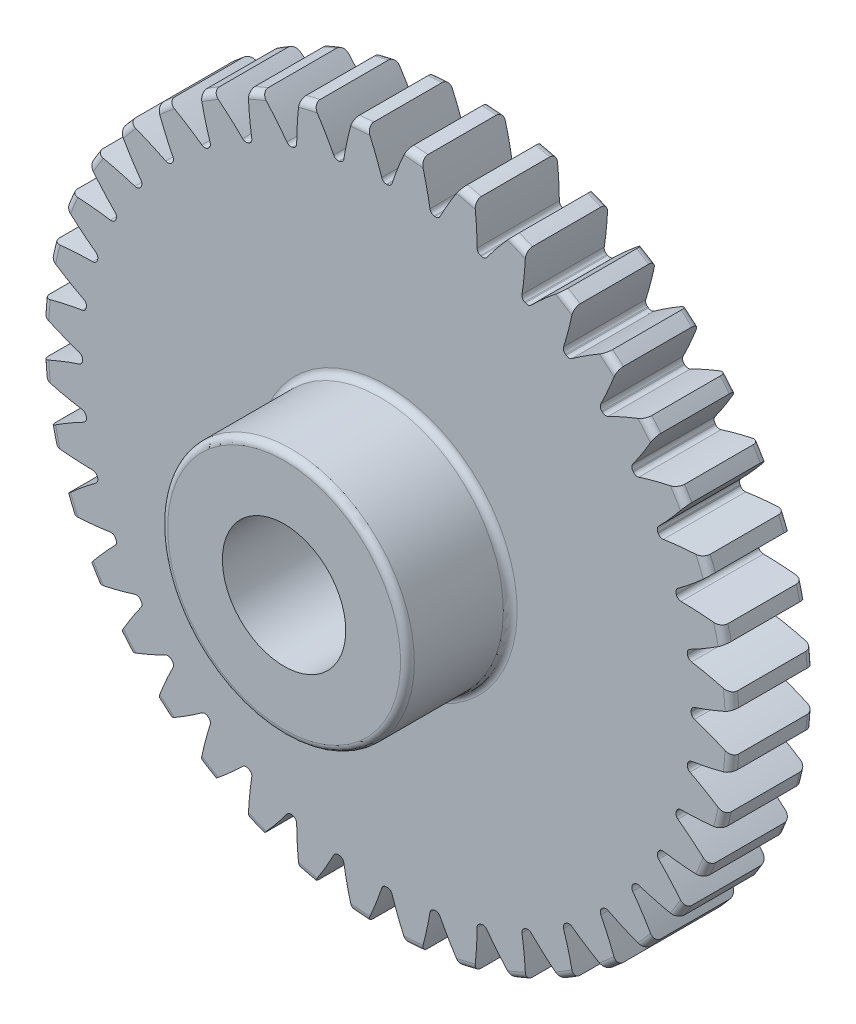
from build123d import *

# Parameters (mm, degrees)
FILLET2_R          = 0.336
CUT_EXTRUDE2_DEPTH = 25.279209282
CIRPATTERN1_COUNT  = 40


with BuildPart() as part:
    # Sketch4 → Revolve1 (revolve)
    with BuildSketch(Plane(origin=(0, 0, 0), x_dir=(0, 0, -1), z_dir=(1, 0, 0))):
        Polygon((-9, 3), (-9, 6), (-4, 6), (-4, 16.8), (0, 16.8), (0, 3), align=None)
    revolve(axis=Axis((0, 0, 4), (0, 0, 1)))

    # Fillet2
    fillet2_edges = [part.edges().sort_by_distance(p)[0] for p in [
        (0, -16.8, 0),
        (0, -16.8, 4),
        (0, -6, 4),
        (0, -6, 9),
    ]]
    fillet(fillet2_edges, radius=FILLET2_R)

    # Sketch7 → Cut-Extrude2 (cut, through all)
    with BuildSketch(Plane.XY.offset(4)):
        with BuildLine():
            ThreePointArc((-0.021567186, 14.799984286), (0, 14.8), (0.021567186, 14.799984286))
            ThreePointArc((0.021567186, 14.799984286), (0.162272627, 14.84530001), (0.249739517, 14.964468291))
            ThreePointArc((0.249739517, 14.964468291), (0.584218852, 15.879135198), (0.973727712, 16.77175764))
            ThreePointArc((0.973727712, 16.77175764), (0, 16.8), (-0.973727712, 16.77175764))
            ThreePointArc((-0.973727712, 16.77175764), (-0.584218852, 15.879135198), (-0.249739517, 14.964468291))
            ThreePointArc((-0.249739517, 14.964468291), (-0.162272627, 14.84530001), (-0.021567186, 14.799984286))
        make_face()
    cut_extrude2 = extrude(amount=-CUT_EXTRUDE2_DEPTH, mode=Mode.SUBTRACT)

    # CirPattern1: Cut-Extrude2 ×40 about axis
    cirpattern1_axis = Axis((0, 0, 0), (0, 0, 1))
    for i in range(1, CIRPATTERN1_COUNT):
        add(cut_extrude2.rotate(cirpattern1_axis, i * 360 / CIRPATTERN1_COUNT), mode=Mode.SUBTRACT)


solid = part.part
